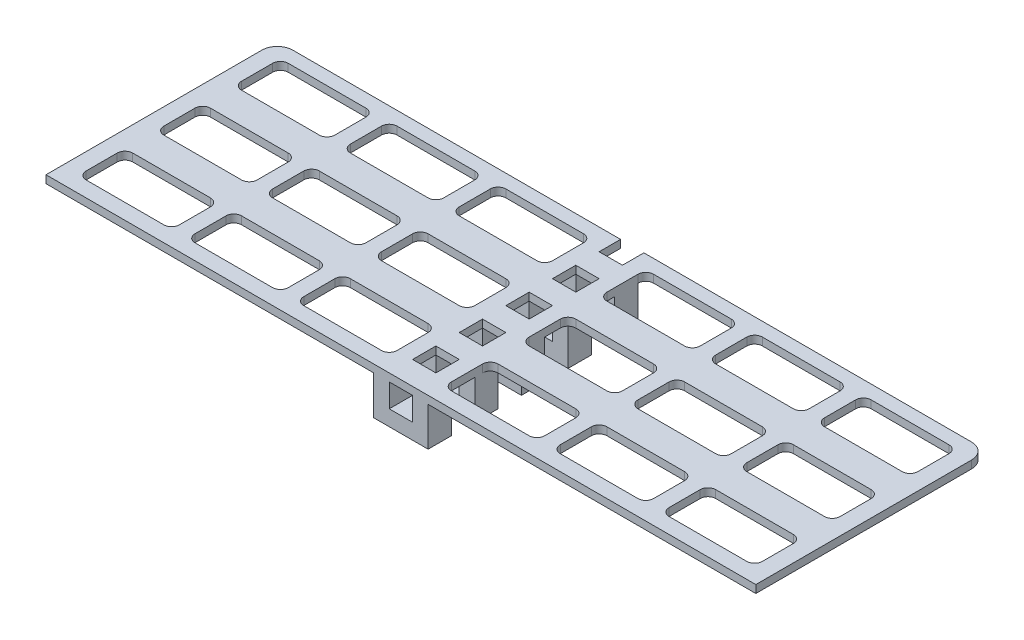
from build123d import *

# Parameters (mm, degrees)
BOSS_EXTRUDE1_DEPTH = 6.35
CUT_EXTRUDE1_DEPTH  = 6.35
SKETCH3_W           = 19.05
SKETCH3_H           = 19.05
BOSS_EXTRUDE2_DEPTH = 6.35
BOSS_EXTRUDE3_DEPTH = 19.05
LPATTERN1_COUNT     = 9
LPATTERN1_PITCH     = 38.1


with BuildPart() as part:
    # Sketch1 → Boss-Extrude1 (new body)
    with BuildSketch(Plane(origin=(0, 0, 0), x_dir=(1, 0, 0), z_dir=(0, 1, 0))):
        with BuildLine():
            Line((0, 0), (280.416, 0))
            Line((280.416, 0), (280.416, 176.276))
            ThreePointArc((280.416, 176.276), (276.696256121, 185.256256121), (267.716, 188.976))
            Line((267.716, 188.976), (0, 188.976))
            Line((0, 188.976), (0, 0))
        make_face()
    boss_extrude1 = extrude(amount=BOSS_EXTRUDE1_DEPTH)

    # Sketch2 → Cut-Extrude1 (cut)
    with BuildSketch(Plane(origin=(0, 6.35, 0), x_dir=(1, 0, 0), z_dir=(0, 1, 0))):
        with BuildLine():
            Line((101.6, 19.05), (101.6, 44.45))
            ThreePointArc((101.6, 44.45), (103.459871939, 48.940128061), (107.95, 50.8))
            Line((107.95, 50.8), (171.45, 50.8))
            ThreePointArc((171.45, 50.8), (175.940128061, 48.940128061), (177.8, 44.45))
            Line((177.8, 44.45), (177.8, 19.05))
            ThreePointArc((177.8, 19.05), (175.940128061, 14.559871939), (171.45, 12.7))
            Line((171.45, 12.7), (107.95, 12.7))
            ThreePointArc((107.95, 12.7), (103.459871939, 14.559871939), (101.6, 19.05))
        make_face()
        with BuildLine():
            Line((19.05, 12.7), (82.55, 12.7))
            ThreePointArc((82.55, 12.7), (87.040128061, 14.559871939), (88.9, 19.05))
            Line((88.9, 19.05), (88.9, 44.45))
            ThreePointArc((88.9, 44.45), (87.040128061, 48.940128061), (82.55, 50.8))
            Line((82.55, 50.8), (19.05, 50.8))
            ThreePointArc((19.05, 50.8), (14.559871939, 48.940128061), (12.7, 44.45))
            Line((12.7, 44.45), (12.7, 19.05))
            ThreePointArc((12.7, 19.05), (14.559871939, 14.559871939), (19.05, 12.7))
        make_face()
        with BuildLine():
            Line((190.5, 19.05), (190.5, 44.45))
            ThreePointArc((190.5, 44.45), (192.359871939, 48.940128061), (196.85, 50.8))
            Line((196.85, 50.8), (260.35, 50.8))
            ThreePointArc((260.35, 50.8), (264.840128061, 48.940128061), (266.7, 44.45))
            Line((266.7, 44.45), (266.7, 19.05))
            ThreePointArc((266.7, 19.05), (264.840128061, 14.559871939), (260.35, 12.7))
            Line((260.35, 12.7), (196.85, 12.7))
            ThreePointArc((196.85, 12.7), (192.359871939, 14.559871939), (190.5, 19.05))
        make_face()
        with BuildLine():
            Line((101.6, 82.55), (101.6, 107.95))
            ThreePointArc((101.6, 107.95), (103.459871939, 112.440128061), (107.95, 114.3))
            Line((107.95, 114.3), (171.45, 114.3))
            ThreePointArc((171.45, 114.3), (175.940128061, 112.440128061), (177.8, 107.95))
            Line((177.8, 107.95), (177.8, 82.55))
            ThreePointArc((177.8, 82.55), (175.940128061, 78.059871939), (171.45, 76.2))
            Line((171.45, 76.2), (107.95, 76.2))
            ThreePointArc((107.95, 76.2), (103.459871939, 78.059871939), (101.6, 82.55))
        make_face()
        with BuildLine():
            Line((190.5, 82.55), (190.5, 107.95))
            ThreePointArc((190.5, 107.95), (192.359871939, 112.440128061), (196.85, 114.3))
            Line((196.85, 114.3), (260.35, 114.3))
            ThreePointArc((260.35, 114.3), (264.840128061, 112.440128061), (266.7, 107.95))
            Line((266.7, 107.95), (266.7, 82.55))
            ThreePointArc((266.7, 82.55), (264.840128061, 78.059871939), (260.35, 76.2))
            Line((260.35, 76.2), (196.85, 76.2))
            ThreePointArc((196.85, 76.2), (192.359871939, 78.059871939), (190.5, 82.55))
        make_face()
        with BuildLine():
            Line((101.6, 146.05), (101.6, 171.45))
            ThreePointArc((101.6, 171.45), (103.459871939, 175.940128061), (107.95, 177.8))
            Line((107.95, 177.8), (171.45, 177.8))
            ThreePointArc((171.45, 177.8), (175.940128061, 175.940128061), (177.8, 171.45))
            Line((177.8, 171.45), (177.8, 146.05))
            ThreePointArc((177.8, 146.05), (175.940128061, 141.559871939), (171.45, 139.7))
            Line((171.45, 139.7), (107.95, 139.7))
            ThreePointArc((107.95, 139.7), (103.459871939, 141.559871939), (101.6, 146.05))
        make_face()
        with BuildLine():
            Line((190.5, 146.05), (190.5, 171.45))
            ThreePointArc((190.5, 171.45), (192.359871939, 175.940128061), (196.85, 177.8))
            Line((196.85, 177.8), (260.35, 177.8))
            ThreePointArc((260.35, 177.8), (264.840128061, 175.940128061), (266.7, 171.45))
            Line((266.7, 171.45), (266.7, 146.05))
            ThreePointArc((266.7, 146.05), (264.840128061, 141.559871939), (260.35, 139.7))
            Line((260.35, 139.7), (196.85, 139.7))
            ThreePointArc((196.85, 139.7), (192.359871939, 141.559871939), (190.5, 146.05))
        make_face()
        with BuildLine():
            Line((12.7, 82.55), (12.7, 107.95))
            ThreePointArc((12.7, 107.95), (14.559871939, 112.440128061), (19.05, 114.3))
            Line((19.05, 114.3), (82.55, 114.3))
            ThreePointArc((82.55, 114.3), (87.040128061, 112.440128061), (88.9, 107.95))
            Line((88.9, 107.95), (88.9, 82.55))
            ThreePointArc((88.9, 82.55), (87.040128061, 78.059871939), (82.55, 76.2))
            Line((82.55, 76.2), (19.05, 76.2))
            ThreePointArc((19.05, 76.2), (14.559871939, 78.059871939), (12.7, 82.55))
        make_face()
        with BuildLine():
            Line((12.7, 146.05), (12.7, 171.45))
            ThreePointArc((12.7, 171.45), (14.559871939, 175.940128061), (19.05, 177.8))
            Line((19.05, 177.8), (82.55, 177.8))
            ThreePointArc((82.55, 177.8), (87.040128061, 175.940128061), (88.9, 171.45))
            Line((88.9, 171.45), (88.9, 146.05))
            ThreePointArc((88.9, 146.05), (87.040128061, 141.559871939), (82.55, 139.7))
            Line((82.55, 139.7), (19.05, 139.7))
            ThreePointArc((19.05, 139.7), (14.559871939, 141.559871939), (12.7, 146.05))
        make_face()
    cut_extrude1 = extrude(amount=-CUT_EXTRUDE1_DEPTH, mode=Mode.SUBTRACT)

    # Sketch3 → Boss-Extrude2 (add)
    with BuildSketch(Plane(origin=(0, 6.35, 0), x_dir=(1, 0, 0), z_dir=(0, 1, 0))):
        with Locations((-9.525, 9.525)):
            Rectangle(SKETCH3_W, SKETCH3_H)
        with Locations((-9.525, 47.625)):
            Rectangle(SKETCH3_W, SKETCH3_H)
        with Locations((-9.525, 85.725)):
            Rectangle(SKETCH3_W, SKETCH3_H)
        with Locations((-9.525, 123.825)):
            Rectangle(SKETCH3_W, SKETCH3_H)
        with Locations((-9.525, 161.925)):
            Rectangle(SKETCH3_W, SKETCH3_H)
    extrude(amount=-BOSS_EXTRUDE2_DEPTH)

    # Mirror3: Boss-Extrude1 across plane
    add(boss_extrude1.mirror(Plane.ZY.offset(9.525)))

    # Mirror2: Cut-Extrude1 across plane
    add(cut_extrude1.mirror(Plane.ZY.offset(9.525)), mode=Mode.SUBTRACT)

    # Sketch5 → Boss-Extrude3 (add)
    with BuildSketch(Plane.XY):
        Polygon((12.7, 0), (0, 0), (0, -19.05), (-19.05, -19.05), (-19.05, 0), (-31.75, 0), (-31.75, -31.75), (12.7, -31.75), align=None)
    boss_extrude3 = extrude(amount=-BOSS_EXTRUDE3_DEPTH)

    # LPattern1: Boss-Extrude3 ×9, 4 skipped
    with Locations(*[(0, 0, -i * LPATTERN1_PITCH) for i in range(1, LPATTERN1_COUNT) if i not in (5, 6, 7, 8)]):
        add(boss_extrude3)


solid = part.part
